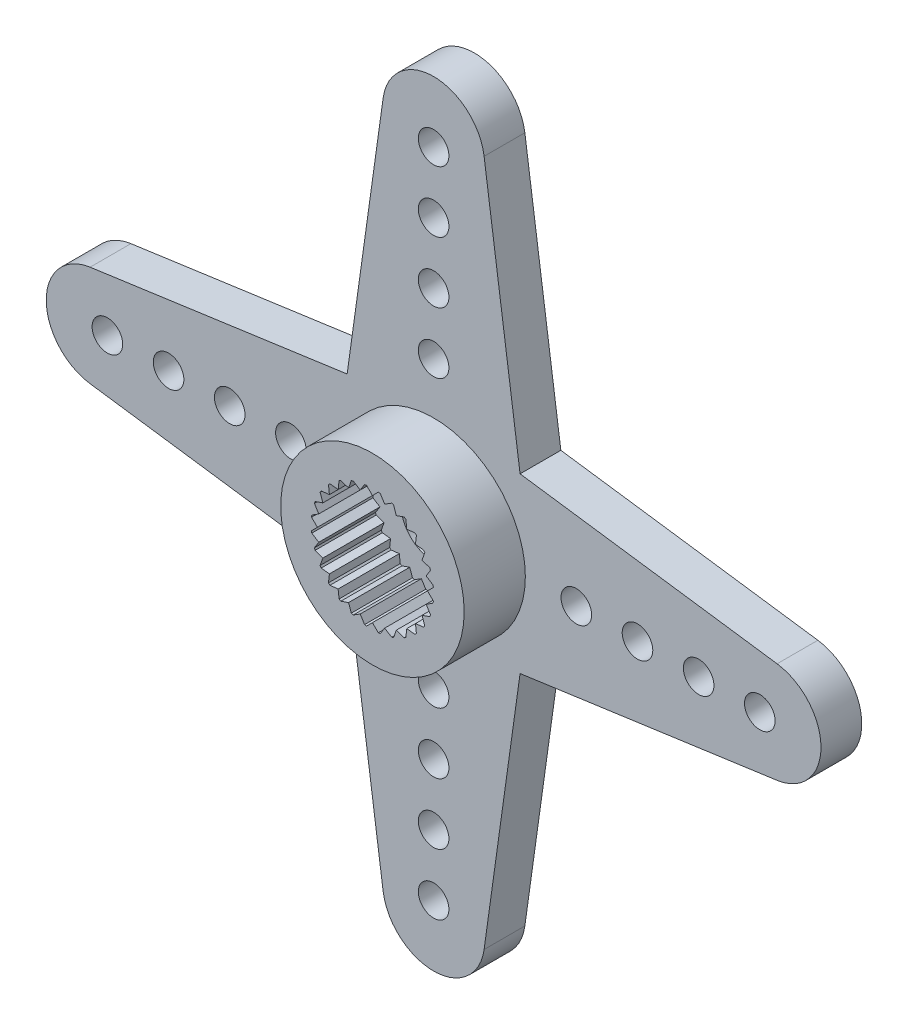
from build123d import *

# Parameters (mm, degrees)
ESQUISSE1_R                  = 5.75
ESQUISSE1_R_2                = 1.6
BOSS_EXTRU_1_DEPTH           = 5
ESQUISSE2_R                  = 3
ENL_V_MAT_EXTRU_1_DEPTH      = 3
ENL_V_START                  = -3
ESQUISSE3_R                  = 5.75
ESQUISSE3_R_2                = 4.5
ENL_V_MAT_EXTRU_2_DEPTH      = 3
BOSS_EXTRU_2_DEPTH           = 2
R_P_TITION_CIRCULAIRE1_COUNT = 4
ESQUISSE5_R                  = 0.75
ENL_V_MAT_EXTRU_3_DEPTH      = 3
R_P_TITION_CIRCULAIRE2_COUNT = 4
BOSS_EXTRU_3_DEPTH           = 3
R_P_TITION_CIRCULAIRE3_COUNT = 28
ENL_V_START_2                = -1
ESQUISSE7_R                  = 3
ESQUISSE7_R_2                = 1.6
ENL_V_MAT_EXTRU_4_DEPTH      = 1
ESQUISSE8_R                  = 4.7
ESQUISSE8_R_2                = 3.4
ENL_V_MAT_EXTRU_5_DEPTH      = 1


with BuildPart() as part:
    # Esquisse1 → Boss.-Extru.1 (new body)
    with BuildSketch(Plane.XY):
        Circle(ESQUISSE1_R)
        Circle(ESQUISSE1_R_2, mode=Mode.SUBTRACT)
    extrude(amount=BOSS_EXTRU_1_DEPTH)

    # Esquisse2 → Enlèv. mat.-Extru.1 (cut)
    with BuildSketch(Plane.XY.offset(5)):
        Circle(ESQUISSE2_R)
    extrude(amount=-ENL_V_MAT_EXTRU_1_DEPTH, mode=Mode.SUBTRACT)

    # Esquisse3 → Enlèv. mat.-Extru.2 (cut)
    with BuildSketch(Plane.XY.offset(5).offset(ENL_V_START)):
        Circle(ESQUISSE3_R)
        Circle(ESQUISSE3_R_2, mode=Mode.SUBTRACT)
    extrude(amount=ENL_V_MAT_EXTRU_2_DEPTH, mode=Mode.SUBTRACT)

    # Esquisse4 → Boss.-Extru.2 (add)
    with BuildSketch(Plane(origin=(0, 0, 0), x_dir=(-1, 0, 0), z_dir=(0, 0, -1))):
        with BuildLine():
            Line((-4.3, 3.817394399), (-2.475852955, 16.846629695))
            ThreePointArc((-2.475852955, 16.846629695), (0, 19), (2.475852955, 16.846629695))
            Line((2.475852955, 16.846629695), (4.3, 3.817394399))
            ThreePointArc((4.3, 3.817394399), (0, 5.75), (-4.3, 3.817394399))
        make_face()
    boss_extru_2 = extrude(amount=-BOSS_EXTRU_2_DEPTH)

    # Répétition circulaire1: Boss.-Extru.2 ×4 about axis
    r_p_tition_circulaire1_axis = Axis((0, 0, 0), (0, 0, 1))
    for i in range(1, R_P_TITION_CIRCULAIRE1_COUNT):
        add(boss_extru_2.rotate(r_p_tition_circulaire1_axis, i * 360 / R_P_TITION_CIRCULAIRE1_COUNT))

    # Esquisse5 → Enlèv. mat.-Extru.3 (cut)
    with BuildSketch(Plane(origin=(0, 0, 0), x_dir=(-1, 0, 0), z_dir=(0, 0, -1))):
        with Locations((0, 7)):
            Circle(ESQUISSE5_R)
        with Locations((0, 10)):
            Circle(ESQUISSE5_R)
        with Locations((0, 13)):
            Circle(ESQUISSE5_R)
        with Locations((0, 16)):
            Circle(ESQUISSE5_R)
    enl_v_mat_extru_3 = extrude(amount=-ENL_V_MAT_EXTRU_3_DEPTH, mode=Mode.SUBTRACT)

    # Répétition circulaire2: Enlèv. mat.-Extru.3 ×4 about axis
    r_p_tition_circulaire2_axis = Axis((0, 0, 0), (0, 0, 1))
    for i in range(1, R_P_TITION_CIRCULAIRE2_COUNT):
        add(enl_v_mat_extru_3.rotate(r_p_tition_circulaire2_axis, i * 360 / R_P_TITION_CIRCULAIRE2_COUNT), mode=Mode.SUBTRACT)

    # Esquisse6 → Boss.-Extru.3 (add)
    with BuildSketch(Plane.XY.offset(5)):
        Polygon((-0.3, 3), (0, 2.7), (0.3, 3), align=None)
    boss_extru_3 = extrude(amount=-BOSS_EXTRU_3_DEPTH)

    # Répétition circulaire3: Boss.-Extru.3 ×28 about axis
    r_p_tition_circulaire3_axis = Axis((0, 0, 0), (0, 0, 1))
    for i in range(1, R_P_TITION_CIRCULAIRE3_COUNT):
        add(boss_extru_3.rotate(r_p_tition_circulaire3_axis, i * 360 / R_P_TITION_CIRCULAIRE3_COUNT))

    # Esquisse7 → Enlèv. mat.-Extru.4 (cut)
    with BuildSketch(Plane(origin=(0, 0, 0), x_dir=(-1, 0, 0), z_dir=(0, 0, -1)).offset(ENL_V_START_2)):
        Circle(ESQUISSE7_R)
        Circle(ESQUISSE7_R_2, mode=Mode.SUBTRACT)
    extrude(amount=ENL_V_MAT_EXTRU_4_DEPTH, mode=Mode.SUBTRACT)

    # Esquisse8 → Enlèv. mat.-Extru.5 (cut)
    with BuildSketch(Plane(origin=(0, 0, 0), x_dir=(-1, 0, 0), z_dir=(0, 0, -1))):
        Circle(ESQUISSE8_R)
        Circle(ESQUISSE8_R_2, mode=Mode.SUBTRACT)
    extrude(amount=-ENL_V_MAT_EXTRU_5_DEPTH, mode=Mode.SUBTRACT)


solid = part.part
